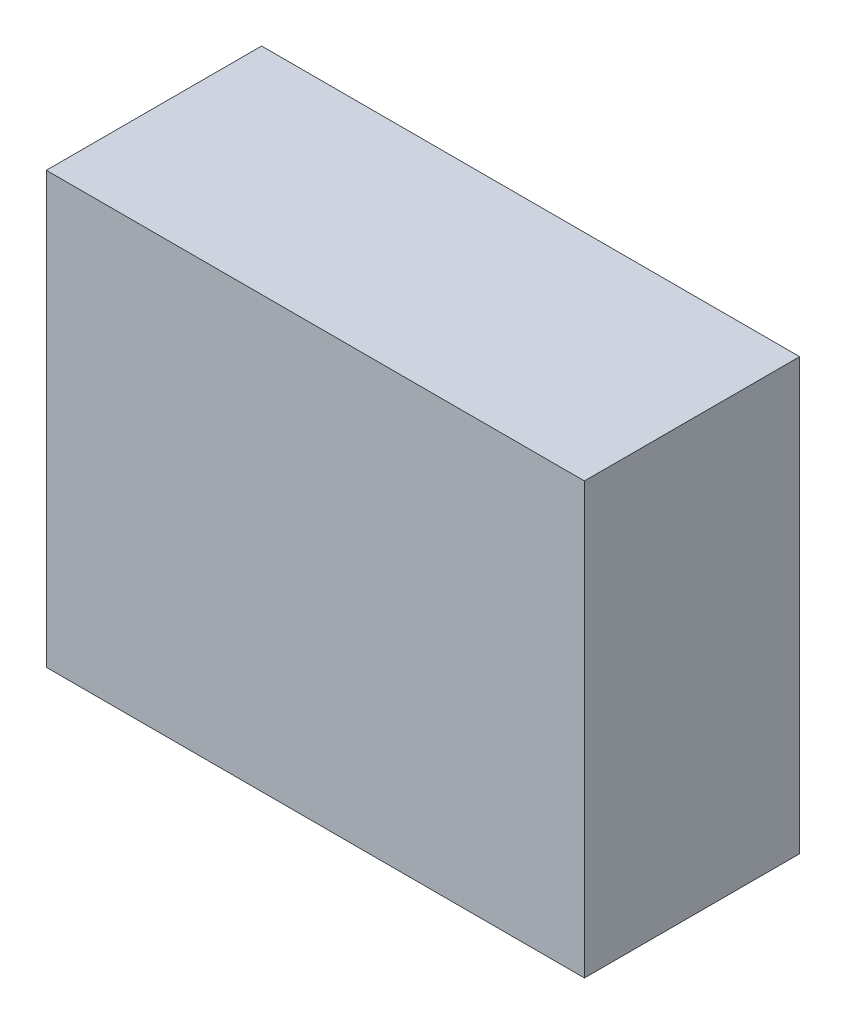
from build123d import *

# Parameters (mm, degrees)
ESBO_O1_W                = 50
ESBO_O1_H                = 20
RESSALTO_EXTRUS_O1_DEPTH = 40


with BuildPart() as part:
    # Esboço1 → Ressalto-extrusão1 (new body)
    with BuildSketch(Plane(origin=(0, 0, 0), x_dir=(1, 0, 0), z_dir=(0, 1, 0))):
        Rectangle(ESBO_O1_W, ESBO_O1_H)
    extrude(amount=RESSALTO_EXTRUS_O1_DEPTH)


solid = part.part
